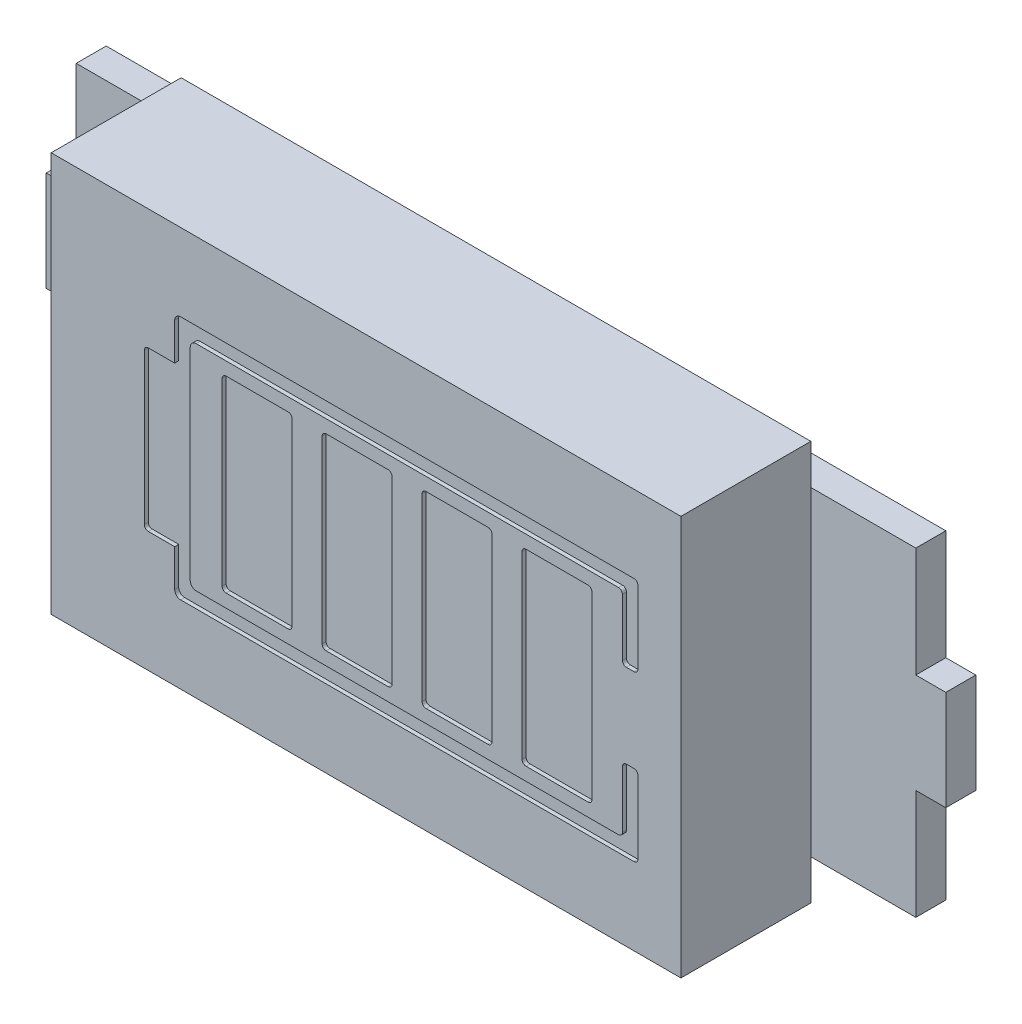
from build123d import *

# Parameters (mm, degrees)
BOSS_EXTRUDE2_DEPTH = 1.5
SKETCH12_W          = 31.5
SKETCH12_H          = 20
BOSS_EXTRUDE3_DEPTH = 6.5
CUT_EXTRUDE6_DEPTH  = 0.2
SKETCH18_W          = 3.5
SKETCH18_H          = 9.4
CUT_EXTRUDE7_DEPTH  = 0.2
SKETCH19_W          = 3.5
SKETCH19_H          = 9.4
CUT_EXTRUDE8_DEPTH  = 0.2
SKETCH24_W          = 3.5
SKETCH24_H          = 9.4
CUT_EXTRUDE9_DEPTH  = 0.2
SKETCH25_W          = 3.5
SKETCH25_H          = 9.4
CUT_EXTRUDE10_DEPTH = 0.2
FILLET3_R           = 0.2
FILLET4_R           = 0.3


with BuildPart() as part:
    # Sketch8 → Boss-Extrude2 (new body)
    with BuildSketch(Plane.XY):
        Polygon((-22.5, -2.5), (-21, -2.5), (-21, -8), (21, -8), (21, -2.5), (22.5, -2.5), (22.5, 2.5), (21, 2.5), (21, 8), (-21, 8), (-21, 2.5), (-22.5, 2.5), align=None)
    extrude(amount=-BOSS_EXTRUDE2_DEPTH)


with BuildPart() as body_2:
    # Sketch12 → Boss-Extrude3 (new body)
    with BuildSketch(Plane.XY.offset(6.5)):
        Rectangle(SKETCH12_W, SKETCH12_H)
    extrude(amount=-BOSS_EXTRUDE3_DEPTH)

    # Sketch13 → Cut-Extrude6 (cut)
    with BuildSketch(Plane.XY.offset(6.5)):
        Polygon((12.823799914, -5.355248942), (-8.795680458, -5.355248942), (-8.795680458, 5.355248942), (12.823799914, 5.355248942), (12.823799914, 2.097392841), (13.600304882, 2.097392841), (13.600304882, 6.131753909), (-9.572185425, 6.131753909), (-9.572185425, 3.976145895), (-11.093791082, 3.976145895), (-11.093791082, -3.976145895), (-9.572185425, -3.976145895), (-9.572185425, -6.131753909), (13.600304882, -6.131753909), (13.600304882, -2.097392841), (12.823799914, -2.097392841), align=None)
    extrude(amount=-CUT_EXTRUDE6_DEPTH, mode=Mode.SUBTRACT)

    # Sketch18 → Cut-Extrude7 (cut)
    with BuildSketch(Plane.XY.offset(6.5)):
        with Locations((-0.45, 0)):
            Rectangle(SKETCH18_W, SKETCH18_H)
    extrude(amount=-CUT_EXTRUDE7_DEPTH, mode=Mode.SUBTRACT)

    # Sketch19 → Cut-Extrude8 (cut)
    with BuildSketch(Plane.XY.offset(6.5)):
        with Locations((-5.45, 0)):
            Rectangle(SKETCH19_W, SKETCH19_H)
    extrude(amount=-CUT_EXTRUDE8_DEPTH, mode=Mode.SUBTRACT)

    # Sketch24 → Cut-Extrude9 (cut)
    with BuildSketch(Plane.XY.offset(6.5)):
        with Locations((4.55, 0)):
            Rectangle(SKETCH24_W, SKETCH24_H)
    extrude(amount=-CUT_EXTRUDE9_DEPTH, mode=Mode.SUBTRACT)

    # Sketch25 → Cut-Extrude10 (cut)
    with BuildSketch(Plane.XY.offset(6.5)):
        with Locations((9.55, 0)):
            Rectangle(SKETCH25_W, SKETCH25_H)
    extrude(amount=-CUT_EXTRUDE10_DEPTH, mode=Mode.SUBTRACT)

    # Fillet3
    fillet3_edges = [body_2.edges().sort_by_distance(p)[0] for p in [
        (7.8, -4.7, 6.4),
        (7.8, 4.7, 6.4),
        (11.3, 4.7, 6.4),
        (11.3, -4.7, 6.4),
        (12.823799914, -5.355248942, 6.4),
        (12.823799914, -2.097392841, 6.4),
        (13.600304882, -2.097392841, 6.4),
        (13.600304882, -6.131753909, 6.4),
        (-11.093791082, -3.976145895, 6.4),
        (-11.093791082, 3.976145895, 6.4),
        (13.600304882, 6.131753909, 6.4),
        (13.600304882, 2.097392841, 6.4),
        (12.823799914, 2.097392841, 6.4),
        (12.823799914, 5.355248942, 6.4),
        (-2.2, -4.7, 6.4),
        (-2.2, 4.7, 6.4),
        (1.3, 4.7, 6.4),
        (1.3, -4.7, 6.4),
        (-7.2, -4.7, 6.4),
        (-7.2, 4.7, 6.4),
        (-3.7, 4.7, 6.4),
        (-3.7, -4.7, 6.4),
        (2.8, -4.7, 6.4),
        (2.8, 4.7, 6.4),
        (6.3, 4.7, 6.4),
        (6.3, -4.7, 6.4),
    ]]
    fillet(fillet3_edges, radius=FILLET3_R)

    # Fillet4
    fillet4_edges = [body_2.edges().sort_by_distance(p)[0] for p in [
        (-9.572185425, -6.131753909, 6.4),
        (-9.572185425, 6.131753909, 6.4),
        (-8.795680458, 5.355248942, 6.4),
        (-8.795680458, -5.355248942, 6.4),
    ]]
    fillet(fillet4_edges, radius=FILLET4_R)


solid = Compound([part.part, body_2.part])
